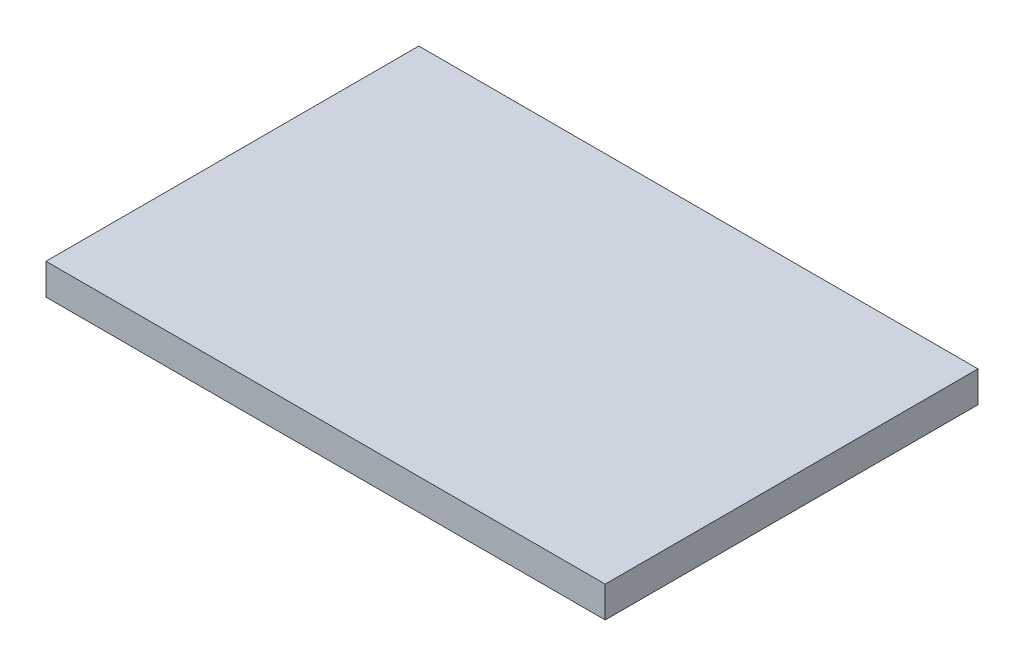
from build123d import *

# Parameters (mm, degrees)
SKETCH1_W           = 457.2
SKETCH1_H           = 304.8
BOSS_EXTRUDE1_DEPTH = 25.4


with BuildPart() as part:
    # Sketch1 → Boss-Extrude1 (new body)
    with BuildSketch(Plane(origin=(0, 0, 0), x_dir=(1, 0, 0), z_dir=(0, 1, 0))):
        Rectangle(SKETCH1_W, SKETCH1_H)
    extrude(amount=BOSS_EXTRUDE1_DEPTH)


solid = part.part
